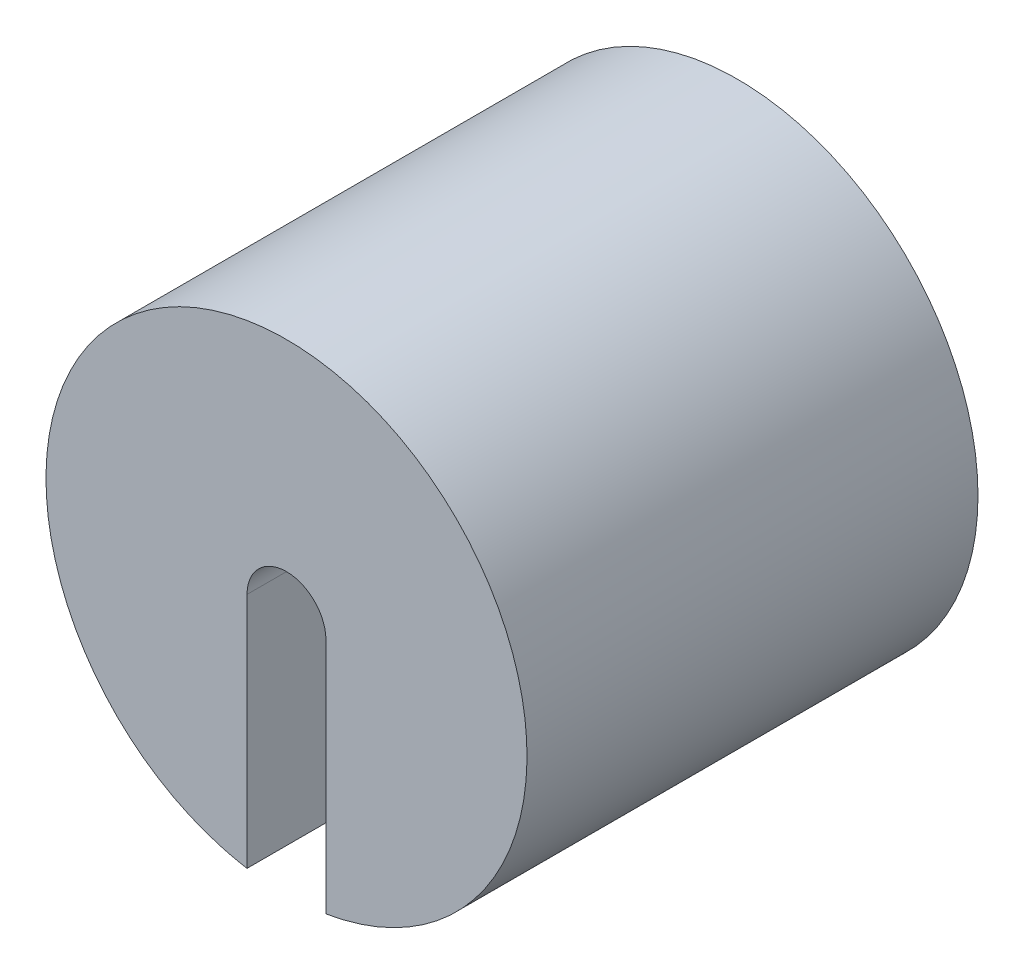
from build123d import *

# Parameters (mm, degrees)
ESQUISSE1_R             = 16
ESQUISSE1_R_2           = 12
BOSS_EXTRU_1_DEPTH      = 30
BOSS_EXTRU_3_START      = 11
ESQUISSE7_R             = 16
BOSS_EXTRU_3_DEPTH      = 19
ESQUISSE4_W             = 8.5
ESQUISSE4_H             = 8.5
ENL_V_MAT_EXTRU_1_DEPTH = 21
ESQUISSE6_W             = 5.25
ESQUISSE6_H             = 9.188661159
ENL_V_MAT_EXTRU_3_DEPTH = 16
ESQUISSE9_R             = 2.625
ENL_V_MAT_EXTRU_4_DEPTH = 19


with BuildPart() as part:
    # Esquisse1 → Boss.-Extru.1 (new body)
    with BuildSketch(Plane.XY):
        with Locations((16, 16)):
            Circle(ESQUISSE1_R)
        with Locations((16, 16)):
            Circle(ESQUISSE1_R_2, mode=Mode.SUBTRACT)
    extrude(amount=BOSS_EXTRU_1_DEPTH)

    # Esquisse7 → Boss.-Extru.3 (add)
    with BuildSketch(Plane.XY.offset(BOSS_EXTRU_3_START)):
        with Locations((16, 16)):
            Circle(ESQUISSE7_R)
    extrude(amount=BOSS_EXTRU_3_DEPTH)

    # Esquisse4 → Enlèv. mat.-Extru.1 (cut)
    with BuildSketch(Plane(origin=(0, 0, 0), x_dir=(1, 0, 0), z_dir=(0, 1, 0))):
        with Locations((16, -19)):
            Rectangle(ESQUISSE4_W, ESQUISSE4_H)
    extrude(amount=ENL_V_MAT_EXTRU_1_DEPTH, mode=Mode.SUBTRACT)

    # Esquisse6 → Enlèv. mat.-Extru.3 (cut)
    with BuildSketch(Plane(origin=(0, 0, 0), x_dir=(1, 0, 0), z_dir=(0, 1, 0))):
        with Locations((16, -27.844330579)):
            Rectangle(ESQUISSE6_W, ESQUISSE6_H)
    extrude(amount=ENL_V_MAT_EXTRU_3_DEPTH, mode=Mode.SUBTRACT)

    # Esquisse9 → Enlèv. mat.-Extru.4 (cut)
    with BuildSketch(Plane.XY.offset(30)):
        with Locations((16, 16)):
            Circle(ESQUISSE9_R)
    extrude(amount=-ENL_V_MAT_EXTRU_4_DEPTH, mode=Mode.SUBTRACT)


solid = part.part
